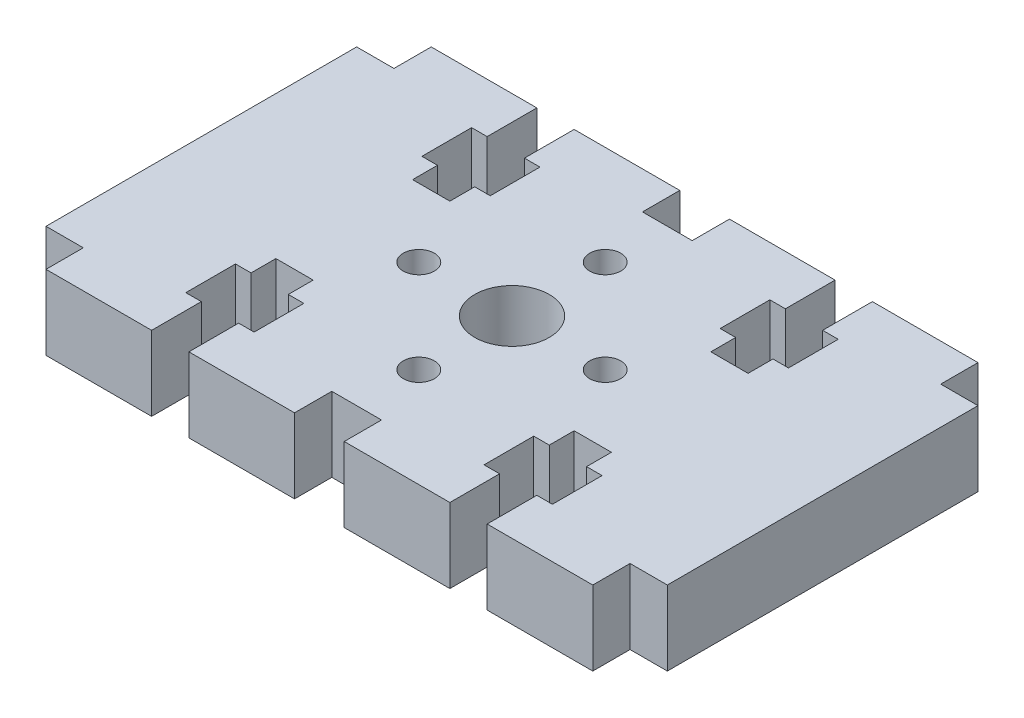
from build123d import *

# Parameters (mm, degrees)
SKETCH_1_R      = 1.25
SKETCH_1_R_2    = 3
EXTRUDE_1_DEPTH = 6


with BuildPart() as part:
    # 草图1 → 凸台-拉伸1 (new body)
    with BuildSketch(Plane(origin=(0, 0, 0), x_dir=(1, 0, 0), z_dir=(0, 1, 0))):
        Polygon((35.5, -24), (34.25, -24), (34.25, -20), (35.5, -20), (35.5, -18), (38.5, -18), (38.5, -20), (39.75, -20), (39.75, -24), (38.5, -24), (38.5, -28), (47, -28), (47, -25), (50, -25), (50, 0), (47, 0), (47, 3), (38.5, 3), (38.5, -1), (39.75, -1), (39.75, -5), (38.5, -5), (38.5, -7), (35.5, -7), (35.5, -5), (34.25, -5), (34.25, -1), (35.5, -1), (35.5, 3), (27, 3), (27, 0), (23, 0), (23, 3), (14.5, 3), (14.5, -1), (15.75, -1), (15.75, -5), (14.5, -5), (14.5, -7), (11.5, -7), (11.5, -5), (10.25, -5), (10.25, -1), (11.5, -1), (11.5, 3), (3, 3), (3, 0), (0, 0), (0, -25), (3, -25), (3, -28), (11.5, -28), (11.5, -24), (10.25, -24), (10.25, -20), (11.5, -20), (11.5, -18), (14.5, -18), (14.5, -20), (15.75, -20), (15.75, -24), (14.5, -24), (14.5, -28), (23, -28), (23, -25), (27, -25), (27, -28), (35.5, -28), align=None)
        with Locations(Location((32.5, -12.5, 0), (0, 0, 270))):
            Circle(SKETCH_1_R, mode=Mode.SUBTRACT)
        with Locations(Location((25, -12.5, 0), (0, 0, 270))):
            Circle(SKETCH_1_R_2, mode=Mode.SUBTRACT)
        with Locations(Location((17.5, -12.5, 0), (0, 0, 270))):
            Circle(SKETCH_1_R, mode=Mode.SUBTRACT)
        with Locations(Location((25, -20, 0), (0, 0, 270))):
            Circle(SKETCH_1_R, mode=Mode.SUBTRACT)
        with Locations(Location((25, -5, 0), (0, 0, 270))):
            Circle(SKETCH_1_R, mode=Mode.SUBTRACT)
    extrude(amount=EXTRUDE_1_DEPTH)


solid = part.part
